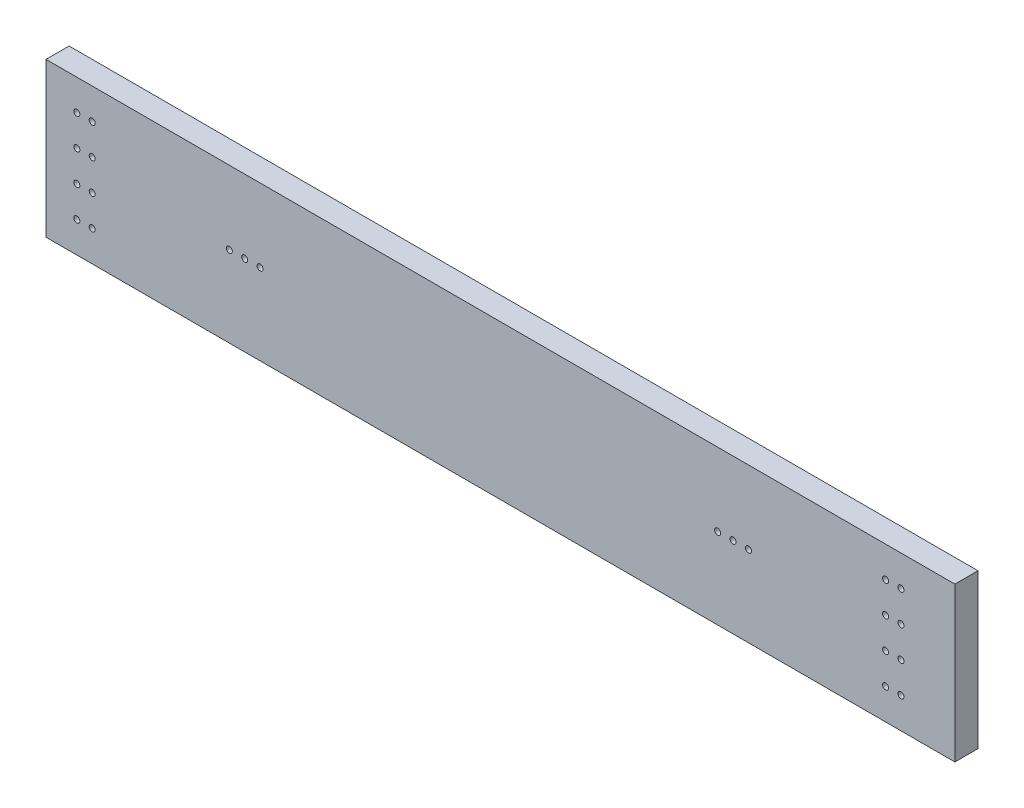
from build123d import *

# Parameters (mm, degrees)
SKETCH1_W           = 749.3
SKETCH1_H           = 127
BOSS_EXTRUDE1_DEPTH = 9.525
SKETCH2_R           = 2.4892
CUT_EXTRUDE1_DEPTH  = 761.225224851


with BuildPart() as part:
    # Sketch1 → Boss-Extrude1 (new, symmetric)
    with BuildSketch(Plane.XY):
        with Locations((374.65, 63.5)):
            Rectangle(SKETCH1_W, SKETCH1_H)
    extrude(amount=BOSS_EXTRUDE1_DEPTH, both=True)

    # Sketch2 → Cut-Extrude1 (cut, through all)
    with BuildSketch(Plane.XY.offset(9.525)):
        with Locations((566.42, 66.675)):
            Circle(SKETCH2_R)
        with Locations((553.72, 66.675)):
            Circle(SKETCH2_R)
        with Locations((163.83, 66.675)):
            Circle(SKETCH2_R)
        with Locations((176.53, 66.675)):
            Circle(SKETCH2_R)
        with Locations((579.12, 66.675)):
            Circle(SKETCH2_R)
        with Locations((151.13, 66.675)):
            Circle(SKETCH2_R)
        with Locations((692.15, 101.6)):
            Circle(SKETCH2_R)
        with Locations((704.85, 101.6)):
            Circle(SKETCH2_R)
        with Locations((704.85, 76.2)):
            Circle(SKETCH2_R)
        with Locations((704.85, 50.8)):
            Circle(SKETCH2_R)
        with Locations((704.85, 25.4)):
            Circle(SKETCH2_R)
        with Locations((692.15, 76.2)):
            Circle(SKETCH2_R)
        with Locations((692.15, 50.8)):
            Circle(SKETCH2_R)
        with Locations((692.15, 25.4)):
            Circle(SKETCH2_R)
        with Locations((25.4, 101.6)):
            Circle(SKETCH2_R)
        with Locations((38.1, 101.6)):
            Circle(SKETCH2_R)
        with Locations((38.1, 76.2)):
            Circle(SKETCH2_R)
        with Locations((38.1, 50.8)):
            Circle(SKETCH2_R)
        with Locations((38.1, 25.4)):
            Circle(SKETCH2_R)
        with Locations((25.4, 76.2)):
            Circle(SKETCH2_R)
        with Locations((25.4, 50.8)):
            Circle(SKETCH2_R)
        with Locations((25.4, 25.4)):
            Circle(SKETCH2_R)
    extrude(amount=-CUT_EXTRUDE1_DEPTH, mode=Mode.SUBTRACT)


solid = part.part
